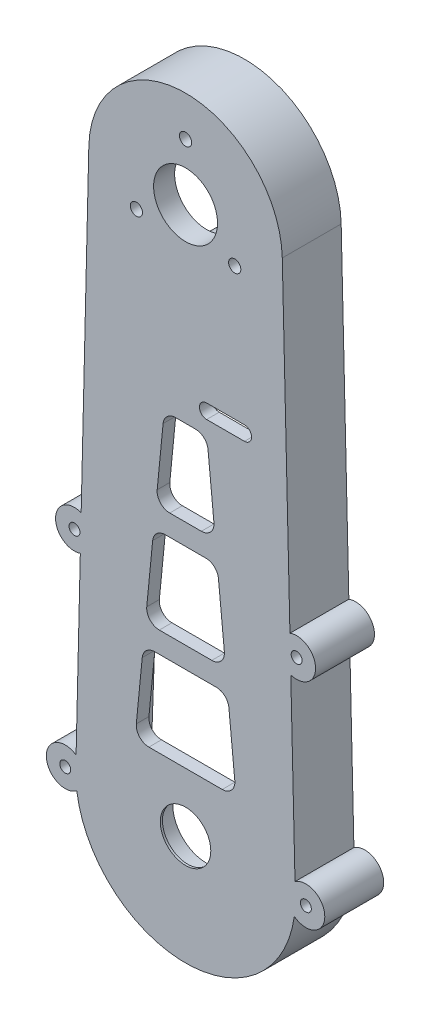
from build123d import *

# Parameters (mm, degrees)
SKETCH1_R            = 6
SKETCH1_R_2          = 1.45
BOSS_EXTRUDE1_DEPTH  = 3
SKETCH2_R            = 20
SKETCH2_R_2          = 1.45
BOSS_EXTRUDE2_DEPTH  = 2
SKETCH3_R            = 12
SKETCH3_R_2          = 6
BOSS_EXTRUDE3_DEPTH  = 2
BOSS_EXTRUDE4_DEPTH  = 11
SKETCH5_R            = 4
SKETCH5_R_2          = 1.3
BOSS_EXTRUDE5_DEPTH  = 9
SKETCH6_R            = 4
SKETCH6_R_2          = 1.3
BOSS_EXTRUDE6_DEPTH  = 9
SKETCH7_R            = 4
SKETCH7_R_2          = 1.3
BOSS_EXTRUDE7_DEPTH  = 9
SKETCH8_R            = 4.5
SKETCH8_R_2          = 1.3
BOSS_EXTRUDE8_DEPTH  = 14
SKETCH9_R            = 4.5
SKETCH9_R_2          = 1.3
BOSS_EXTRUDE9_DEPTH  = 14
SKETCH10_R           = 4.5
SKETCH10_R_2         = 1.3
BOSS_EXTRUDE10_DEPTH = 14
SKETCH11_R           = 4.5
SKETCH11_R_2         = 1.3
BOSS_EXTRUDE11_DEPTH = 14
SKETCH12_R           = 7.6
CUT_EXTRUDE1_DEPTH   = 5
SKETCH13_R           = 8.05
CUT_EXTRUDE2_DEPTH   = 4.5


with BuildPart() as part:
    # Sketch1 → Boss-Extrude1 (new body)
    with BuildSketch(Plane.XY.offset(344.5)):
        with BuildLine():
            Line((277.006534343, 300.548212638), (273.908821488, 170.622068635))
            ThreePointArc((273.908821488, 170.622068635), (300, 143.901406829), (326.091178512, 170.622068635))
            Line((326.091178512, 170.622068635), (322.993465657, 300.548212638))
            ThreePointArc((322.993465657, 300.548212638), (300, 323), (277.006534343, 300.548212638))
        make_face()
        with Locations((300, 170)):
            Circle(SKETCH1_R, mode=Mode.SUBTRACT)
        with Locations((300, 313.5)):
            Circle(SKETCH1_R_2, mode=Mode.SUBTRACT)
        with Locations((288.308657049, 293.25)):
            Circle(SKETCH1_R_2, mode=Mode.SUBTRACT)
        with Locations((311.691342951, 293.25)):
            Circle(SKETCH1_R_2, mode=Mode.SUBTRACT)
        with BuildLine():
            Line((305, 258.3), (314, 258.3))
            ThreePointArc((314, 258.3), (315.7, 260), (314, 261.7))
            Line((314, 261.7), (305, 261.7))
            ThreePointArc((305, 261.7), (303.3, 260), (305, 258.3))
        make_face(mode=Mode.SUBTRACT)
        with BuildLine():
            Line((294.661250685, 252.292425307), (293.257422469, 237.959091974))
            ThreePointArc((293.257422469, 237.959091974), (294.02083171, 235.651384543), (296.243136361, 234.666666667))
            Line((296.243136361, 234.666666667), (303.756863639, 234.666666667))
            ThreePointArc((303.756863639, 234.666666667), (305.97916829, 235.651384543), (306.742577531, 237.959091974))
            Line((306.742577531, 237.959091974), (305.338749315, 252.292425307))
            ThreePointArc((305.338749315, 252.292425307), (304.368317547, 254.222304651), (302.353035423, 255))
            Line((302.353035423, 255), (297.646964577, 255))
            ThreePointArc((297.646964577, 255), (295.631682453, 254.222304651), (294.661250685, 252.292425307))
        make_face(mode=Mode.SUBTRACT)
        with BuildLine():
            Line((292.180065932, 226.959091974), (290.776237716, 212.625758641))
            ThreePointArc((290.776237716, 212.625758641), (291.539646956, 210.318051209), (293.761951607, 209.333333333))
            Line((293.761951607, 209.333333333), (306.238048393, 209.333333333))
            ThreePointArc((306.238048393, 209.333333333), (308.460353044, 210.318051209), (309.223762284, 212.625758641))
            Line((309.223762284, 212.625758641), (307.819934068, 226.959091974))
            ThreePointArc((307.819934068, 226.959091974), (306.849502301, 228.888971317), (304.834220177, 229.666666667))
            Line((304.834220177, 229.666666667), (295.165779823, 229.666666667))
            ThreePointArc((295.165779823, 229.666666667), (293.150497699, 228.888971317), (292.180065932, 226.959091974))
        make_face(mode=Mode.SUBTRACT)
        with BuildLine():
            Line((289.698881178, 201.625758641), (288.295052962, 187.292425307))
            ThreePointArc((288.295052962, 187.292425307), (289.058462202, 184.984717876), (291.280766853, 184))
            Line((291.280766853, 184), (308.719233147, 184))
            ThreePointArc((308.719233147, 184), (310.941537798, 184.984717876), (311.704947038, 187.292425307))
            Line((311.704947038, 187.292425307), (310.301118822, 201.625758641))
            ThreePointArc((310.301118822, 201.625758641), (309.330687055, 203.555637984), (307.315404931, 204.333333333))
            Line((307.315404931, 204.333333333), (292.684595069, 204.333333333))
            ThreePointArc((292.684595069, 204.333333333), (290.669312945, 203.555637984), (289.698881178, 201.625758641))
        make_face(mode=Mode.SUBTRACT)
    extrude(amount=BOSS_EXTRUDE1_DEPTH)

    # Sketch2 → Boss-Extrude2 (add)
    with BuildSketch(Plane.XY.offset(342.5)):
        with Locations((300, 300)):
            Circle(SKETCH2_R)
        with Locations((300, 313.5)):
            Circle(SKETCH2_R_2, mode=Mode.SUBTRACT)
        with Locations((288.308657049, 293.25)):
            Circle(SKETCH2_R_2, mode=Mode.SUBTRACT)
        with Locations((311.691342951, 293.25)):
            Circle(SKETCH2_R_2, mode=Mode.SUBTRACT)
    extrude(amount=BOSS_EXTRUDE2_DEPTH)

    # Sketch3 → Boss-Extrude3 (add)
    with BuildSketch(Plane.XY.offset(342.5)):
        with Locations((300, 170)):
            Circle(SKETCH3_R)
        with Locations((300, 170)):
            Circle(SKETCH3_R_2, mode=Mode.SUBTRACT)
    extrude(amount=BOSS_EXTRUDE3_DEPTH)

    # Sketch4 → Boss-Extrude4 (add)
    with BuildSketch(Plane.XY.offset(333.5)):
        with BuildLine():
            Line((277.006534343, 300.548212638), (273.908821488, 170.622068635))
            ThreePointArc((273.908821488, 170.622068635), (300, 143.901406829), (326.091178512, 170.622068635))
            Line((326.091178512, 170.622068635), (322.993465657, 300.548212638))
            ThreePointArc((322.993465657, 300.548212638), (300, 323), (277.006534343, 300.548212638))
        make_face()
        with BuildLine():
            Line((282.510952348, 300.619041388), (277.9152372, 170.781711074))
            ThreePointArc((277.9152372, 170.781711074), (300, 147.901406829), (322.0847628, 170.781711074))
            Line((322.0847628, 170.781711074), (317.489047652, 300.619041388))
            ThreePointArc((317.489047652, 300.619041388), (300, 317.5), (282.510952348, 300.619041388))
        make_face(mode=Mode.SUBTRACT)
    extrude(amount=BOSS_EXTRUDE4_DEPTH)

    # Sketch5 → Boss-Extrude5 (add)
    with BuildSketch(Plane.XY.offset(333.5)):
        with Locations((312.124355653, 307)):
            Circle(SKETCH5_R)
        with Locations((312.124355653, 307)):
            Circle(SKETCH5_R_2, mode=Mode.SUBTRACT)
    extrude(amount=BOSS_EXTRUDE5_DEPTH)

    # Sketch6 → Boss-Extrude6 (add)
    with BuildSketch(Plane.XY.offset(333.5)):
        with Locations((287.875644347, 307)):
            Circle(SKETCH6_R)
        with Locations((287.875644347, 307)):
            Circle(SKETCH6_R_2, mode=Mode.SUBTRACT)
    extrude(amount=BOSS_EXTRUDE6_DEPTH)

    # Sketch7 → Boss-Extrude7 (add)
    with BuildSketch(Plane.XY.offset(333.5)):
        with Locations((300, 286)):
            Circle(SKETCH7_R)
        with Locations((300, 286)):
            Circle(SKETCH7_R_2, mode=Mode.SUBTRACT)
    extrude(amount=BOSS_EXTRUDE7_DEPTH)

    # Sketch8 → Boss-Extrude8 (add)
    with BuildSketch(Plane.XY.offset(333.5)):
        with Locations((273.593173433, 220)):
            Circle(SKETCH8_R)
        with Locations((273.593173433, 220)):
            Circle(SKETCH8_R_2, mode=Mode.SUBTRACT)
    extrude(amount=BOSS_EXTRUDE8_DEPTH)

    # Sketch9 → Boss-Extrude9 (add)
    with BuildSketch(Plane.XY.offset(333.5)):
        with Locations((326.406826567, 220)):
            Circle(SKETCH9_R)
        with Locations((326.406826567, 220)):
            Circle(SKETCH9_R_2, mode=Mode.SUBTRACT)
    extrude(amount=BOSS_EXTRUDE9_DEPTH)

    # Sketch10 → Boss-Extrude10 (add)
    with BuildSketch(Plane.XY.offset(333.5)):
        with Locations((271.401406829, 170)):
            Circle(SKETCH10_R)
        with Locations((271.401406829, 170)):
            Circle(SKETCH10_R_2, mode=Mode.SUBTRACT)
    extrude(amount=BOSS_EXTRUDE10_DEPTH)

    # Sketch11 → Boss-Extrude11 (add)
    with BuildSketch(Plane.XY.offset(333.5)):
        with Locations((328.598593171, 170)):
            Circle(SKETCH11_R)
        with Locations((328.598593171, 170)):
            Circle(SKETCH11_R_2, mode=Mode.SUBTRACT)
    extrude(amount=BOSS_EXTRUDE11_DEPTH)

    # Sketch12 → Cut-Extrude1 (cut)
    with BuildSketch(Plane.XY.offset(342.5)):
        with Locations((300, 300)):
            Circle(SKETCH12_R)
    extrude(amount=CUT_EXTRUDE1_DEPTH, mode=Mode.SUBTRACT)

    # Sketch13 → Cut-Extrude2 (cut)
    with BuildSketch(Plane.XY.offset(342.5)):
        with Locations((300, 170)):
            Circle(SKETCH13_R)
    extrude(amount=CUT_EXTRUDE2_DEPTH, mode=Mode.SUBTRACT)


solid = part.part
